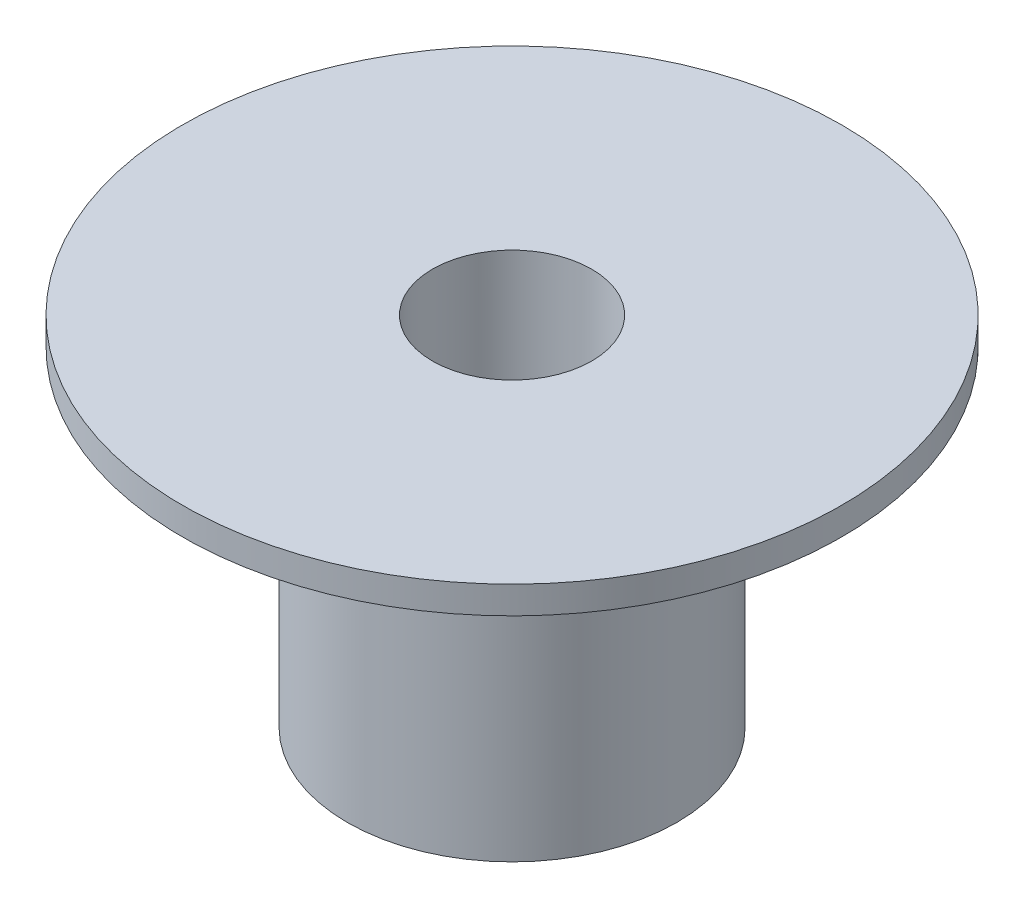
from build123d import *

# Parameters (mm, degrees)
M3_5X0_6_TAPPED_HOLE1_D = 2.9


with BuildPart() as part:
    # Sketch1 → Revolve1 (revolve)
    with BuildSketch(Plane(origin=(0, 0, 0), x_dir=(0, 0, -1), z_dir=(1, 0, 0))):
        Polygon((0, 0), (6, 0), (6, -0.5), (3, -0.5), (3, -6.5), (0, -6.5), align=None)
    revolve(axis=Axis((0, -6.5, 0), (0, 1, 0)))

    # M3.5x0.6 Tapped Hole1 (through all)
    with Locations(Plane.XZ.offset(6.5)):
        with Locations((0, 0)):
            Hole(M3_5X0_6_TAPPED_HOLE1_D / 2)


solid = part.part
